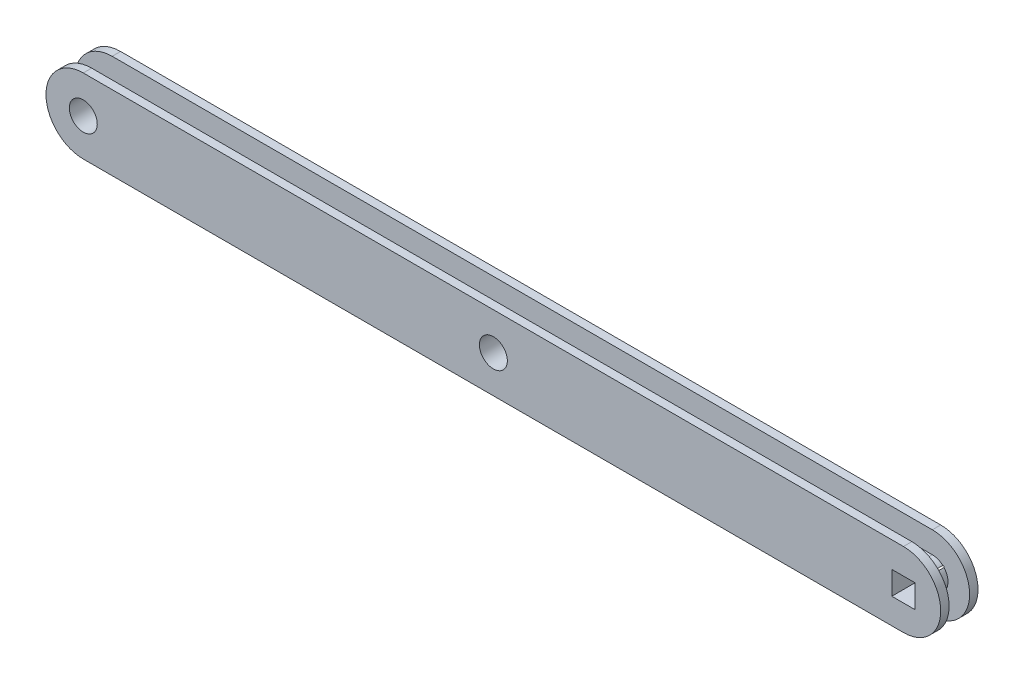
from build123d import *

# Parameters (mm, degrees)
ESQUISSE1_W             = 152.4
ESQUISSE1_H             = 12.7
BOSS_EXTRU_1_DEPTH      = 6.35
ESQUISSE2_W             = 3.967596046
ESQUISSE2_H             = 3.967596046
ESQUISSE2_W_2           = 3.367596046
ESQUISSE2_H_2           = 3.367596046
ESQUISSE2_W_3           = 3.167596046
ESQUISSE2_H_3           = 3.167596046
ESQUISSE2_R             = 2.38125
ENL_V_MAT_EXTRU_1_DEPTH = 154.060029074
SKETCH1_W               = 14.17076538
SKETCH1_H               = 3.495000122
CUT_REVOLVE1_ANGLE      = 180
SKETCH2_W               = 3.495000122
SKETCH2_H               = 3.683
CUT_EXTRUDE1_DEPTH      = 154.060029074
ESQUISSE2_3_W           = 3.367596046
ESQUISSE2_3_H           = 3.367596046
ESQUISSE2_3_W_2         = 3.167596046
ESQUISSE2_3_H_2         = 3.167596046
CUT_EXTRUDE2_DEPTH      = 154.060029074


with BuildPart() as part:
    # Esquisse1 → Boss.-Extru.1 (new body)
    with BuildSketch(Plane.XY):
        with Locations((-76.2, 6.35)):
            Rectangle(ESQUISSE1_W, ESQUISSE1_H)
    extrude(amount=-BOSS_EXTRU_1_DEPTH)

    # Esquisse2 → Enlèv. mat.-Extru.1 (cut, through all)
    # profile 1 of 8: a face of its own
    with BuildSketch(Plane.XY):
        with BuildLine():
            Line((0, 0), (0, 6.35))
            ThreePointArc((0, 6.35), (-1.859871939, 1.859871939), (-6.35, 0))
            Line((-6.35, 0), (0, 0))
        make_face()
    # profile 2 of 8: a face of its own
    with BuildSketch(Plane.XY):
        with BuildLine():
            Line((0, 12.7), (-6.35, 12.7))
            ThreePointArc((-6.35, 12.7), (-1.859871939, 10.840128061), (0, 6.35))
            Line((0, 6.35), (0, 12.7))
        make_face()
    # profile 3 of 8: a face of its own
    with BuildSketch(Plane.XY):
        with BuildLine():
            ThreePointArc((-152.4, 6.35), (-150.540128061, 10.840128061), (-146.05, 12.7))
            Line((-146.05, 12.7), (-152.4, 12.7))
            Line((-152.4, 12.7), (-152.4, 6.35))
        make_face()
    # profile 4 of 8: a face of its own
    with BuildSketch(Plane.XY):
        with BuildLine():
            ThreePointArc((-146.05, 0), (-150.540128061, 1.859871939), (-152.4, 6.35))
            Line((-152.4, 6.35), (-152.4, 0))
            Line((-152.4, 0), (-146.05, 0))
        make_face()
    # profile 5 of 8: a face of its own
    with BuildSketch(Plane.XY):
        with Locations((-6.35, 6.35)):
            Rectangle(ESQUISSE2_W, ESQUISSE2_H)
        with Locations((-6.35, 6.35)):
            Rectangle(ESQUISSE2_W_2, ESQUISSE2_H_2, mode=Mode.SUBTRACT)
    # profile 6 of 8: a face of its own
    with BuildSketch(Plane.XY):
        with Locations((-6.35, 6.35)):
            Rectangle(ESQUISSE2_W_3, ESQUISSE2_H_3)
    # profile 7 of 8: a face of its own
    with BuildSketch(Plane.XY):
        with Locations((-146.05, 6.35)):
            Circle(ESQUISSE2_R)
    # profile 8 of 8: a face of its own
    with BuildSketch(Plane.XY):
        with Locations((-76.2, 6.35)):
            Circle(ESQUISSE2_R)
    extrude(amount=-ENL_V_MAT_EXTRU_1_DEPTH, mode=Mode.SUBTRACT)


with BuildPart() as enl_v_mat_extru_1_piece_1:
    # of the separate pieces the step leaves, piece 1, a body of its own (enl_v_mat_extru_1_pieces)
    add(part.part.solids().sort_by_distance((-6.35, 0, 0))[0])

    # Sketch1 → Cut-Revolve1 (revolve, symmetric, cut)
    with BuildSketch(Plane(origin=(0, 6.35, 0), x_dir=(1, 0, 0), z_dir=(0, 1, 0))) as cut_revolve1_sk:
        Polygon((-150.5585, 1.427499939), (-152.4, 1.427499939), (-152.4, 4.922500061), (-150.5585, 4.922500061), (-148.717, 4.922500061), (-148.717, 1.427499939), align=None)
        with Locations((-159.48538269, 3.175)):
            Rectangle(SKETCH1_W, SKETCH1_H)
    cut_revolve1 = revolve(axis=Axis((-146.05, 6.35, -6.35), (0, 0, 1)), revolution_arc=CUT_REVOLVE1_ANGLE / 2, mode=Mode.SUBTRACT)
    cut_revolve1 = cut_revolve1 + revolve(cut_revolve1_sk.sketch, axis=Axis((-146.05, 6.35, -6.35), (0, 0, -1)), revolution_arc=CUT_REVOLVE1_ANGLE / 2, mode=Mode.SUBTRACT)

    # Mirror1: Cut-Revolve1 across plane
    add(cut_revolve1.mirror(Plane(origin=(-76.2, 0, 0), x_dir=(0, 0, 1), z_dir=(1, 0, 0))), mode=Mode.SUBTRACT)

    # Sketch2 → Cut-Extrude1 (cut, through all)
    with BuildSketch(Plane(origin=(0, 0, 0), x_dir=(0, 0, -1), z_dir=(1, 0, 0))):
        with Locations((3.175, 10.8585)):
            Rectangle(SKETCH2_W, SKETCH2_H)
    cut_extrude1 = extrude(amount=-CUT_EXTRUDE1_DEPTH, mode=Mode.SUBTRACT)

    # Mirror2: Cut-Extrude1 across plane
    add(cut_extrude1.mirror(Plane.ZX.offset(6.35)), mode=Mode.SUBTRACT)


with BuildPart() as enl_v_mat_extru_1_piece_2:
    # of the separate pieces the step leaves, piece 2, a body of its own (enl_v_mat_extru_1_pieces)
    add(part.part.solids().sort_by_distance((-8.033798023, 4.666201977, 0))[0])

    # Esquisse2<3> → Cut-Extrude2 (cut, through all)
    with BuildSketch(Plane.XY):
        with Locations((-6.35, 6.35)):
            Rectangle(ESQUISSE2_3_W, ESQUISSE2_3_H)
        with Locations((-6.35, 6.35)):
            Rectangle(ESQUISSE2_3_W_2, ESQUISSE2_3_H_2, mode=Mode.SUBTRACT)
    extrude(amount=-CUT_EXTRUDE2_DEPTH, mode=Mode.SUBTRACT)


solid = enl_v_mat_extru_1_piece_1.part
